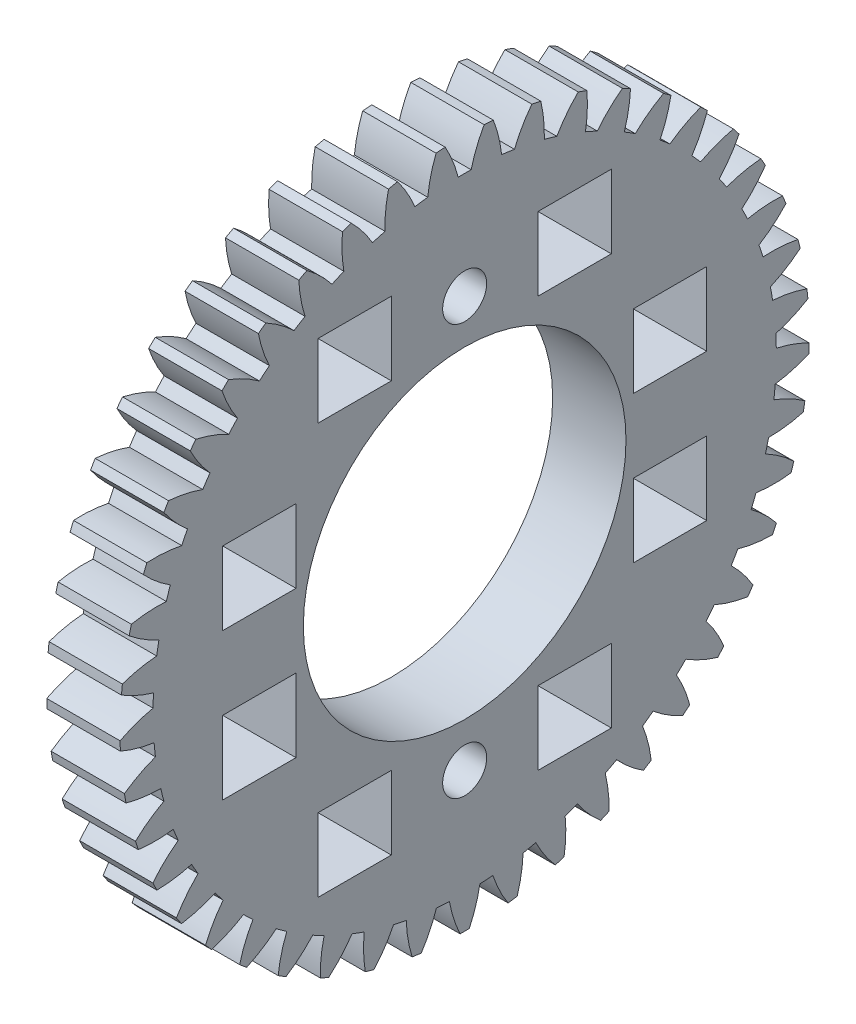
from build123d import *

# Parameters (mm, degrees)
BASPROSKE_W        = 5
BASPROSKE_H        = 23.5
TOOTHCUT_DEPTH     = 34.608034754
TEETHCUTS_COUNT    = 45
TEETHCUTS_ANGLE    = 352
BORSKE_R           = 5
BORE_DEPTH         = 50.0000508
SKETCH1_R          = 1.5
SKETCH1_R_2        = 11
SKETCH1_W          = 5
SKETCH1_H          = 5
CUT_EXTRUDE1_DEPTH = 10


with BuildPart() as part:
    # BasProSke → Base-Revolve (revolve)
    with BuildSketch(Plane(origin=(0, 0, 0), x_dir=(1, 0, 0), z_dir=(0, 1, 0)), mode=Mode.PRIVATE) as base_revolve_sk:
        with Locations((2.5, 11.75)):
            Rectangle(BASPROSKE_W, BASPROSKE_H)
    revolve(base_revolve_sk.sketch.rotate(Axis((-10, 0, 0), (1, 0, 0)), 180), axis=Axis((-10, 0, 0), (1, 0, 0)))

    # TooCutSke → ToothCut (cut, through all)
    with BuildSketch(Plane(origin=(0, 0, 0), x_dir=(0, 0, -1), z_dir=(1, 0, 0))):
        with BuildLine():
            ThreePointArc((0.442593582, 21.244390128), (0, 21.249), (-0.442593582, 21.244390128))
            ThreePointArc((-0.442593582, 21.244390128), (-0.816027501, 22.396050003), (-1.340654493, 23.487168639))
            ThreePointArc((-1.340654493, 23.487168639), (0, 23.5254), (1.340654493, 23.487168639))
            ThreePointArc((1.340654493, 23.487168639), (0.816027501, 22.396050003), (0.442593582, 21.244390128))
        make_face()
    toothcut = extrude(amount=TOOTHCUT_DEPTH, mode=Mode.SUBTRACT)

    # TeethCuts: ToothCut ×45 about axis
    teethcuts_axis = Axis((-10, 0, 0), (1, 0, 0))
    for i in range(1, TEETHCUTS_COUNT):
        add(toothcut.rotate(teethcuts_axis, i * TEETHCUTS_ANGLE / (TEETHCUTS_COUNT - 1)), mode=Mode.SUBTRACT)

    # BorSke → Bore (cut, symmetric)
    with BuildSketch(Plane(origin=(0, 0, 0), x_dir=(0, 0, -1), z_dir=(1, 0, 0))):
        with Locations(Location((0, 0, 0), (0, 0, 180))):
            Circle(BORSKE_R)
    extrude(amount=BORE_DEPTH, both=True, mode=Mode.SUBTRACT)

    # Sketch1 → Cut-Extrude1 (cut)
    with BuildSketch(Plane(origin=(5, 0, 0), x_dir=(0, 0, -1), z_dir=(1, 0, 0))):
        with Locations((0, 14)):
            Circle(SKETCH1_R)
        with Locations((0, -14)):
            Circle(SKETCH1_R)
        Circle(SKETCH1_R_2)
        with Locations((-7.5, 14)):
            Rectangle(SKETCH1_W, SKETCH1_H)
        with Locations((7.5, 14)):
            Rectangle(SKETCH1_W, SKETCH1_H)
        with Locations((-7.5, -14)):
            Rectangle(SKETCH1_W, SKETCH1_H)
        with Locations((7.5, -14)):
            Rectangle(SKETCH1_W, SKETCH1_H)
        with Locations((-14, -5)):
            Rectangle(SKETCH1_W, SKETCH1_H)
        with Locations((-14, 5)):
            Rectangle(SKETCH1_W, SKETCH1_H)
        with Locations((14, -5)):
            Rectangle(SKETCH1_W, SKETCH1_H)
        with Locations((14, 5)):
            Rectangle(SKETCH1_W, SKETCH1_H)
    extrude(amount=-CUT_EXTRUDE1_DEPTH, mode=Mode.SUBTRACT)


solid = part.part
